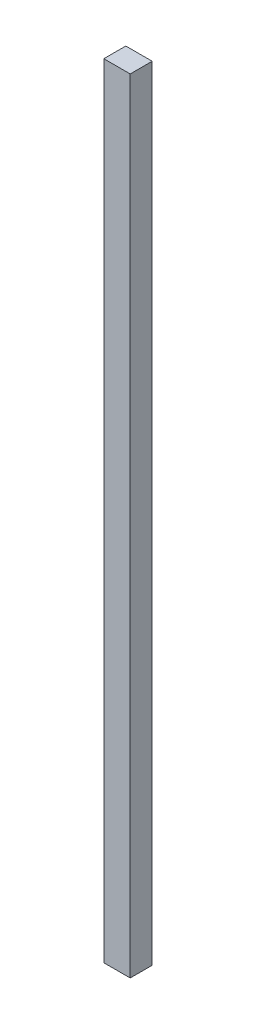
from build123d import *

# Parameters (mm, degrees)
SKETCH_1_W          = 6
SKETCH_1_H          = 178
FIXED_UPRIGHT_DEPTH = 5


with BuildPart() as part:
    # 草图1 → Fixed_upright (new body)
    with BuildSketch(Plane.XY):
        with Locations((3, 89)):
            Rectangle(SKETCH_1_W, SKETCH_1_H)
    extrude(amount=FIXED_UPRIGHT_DEPTH)


solid = part.part
